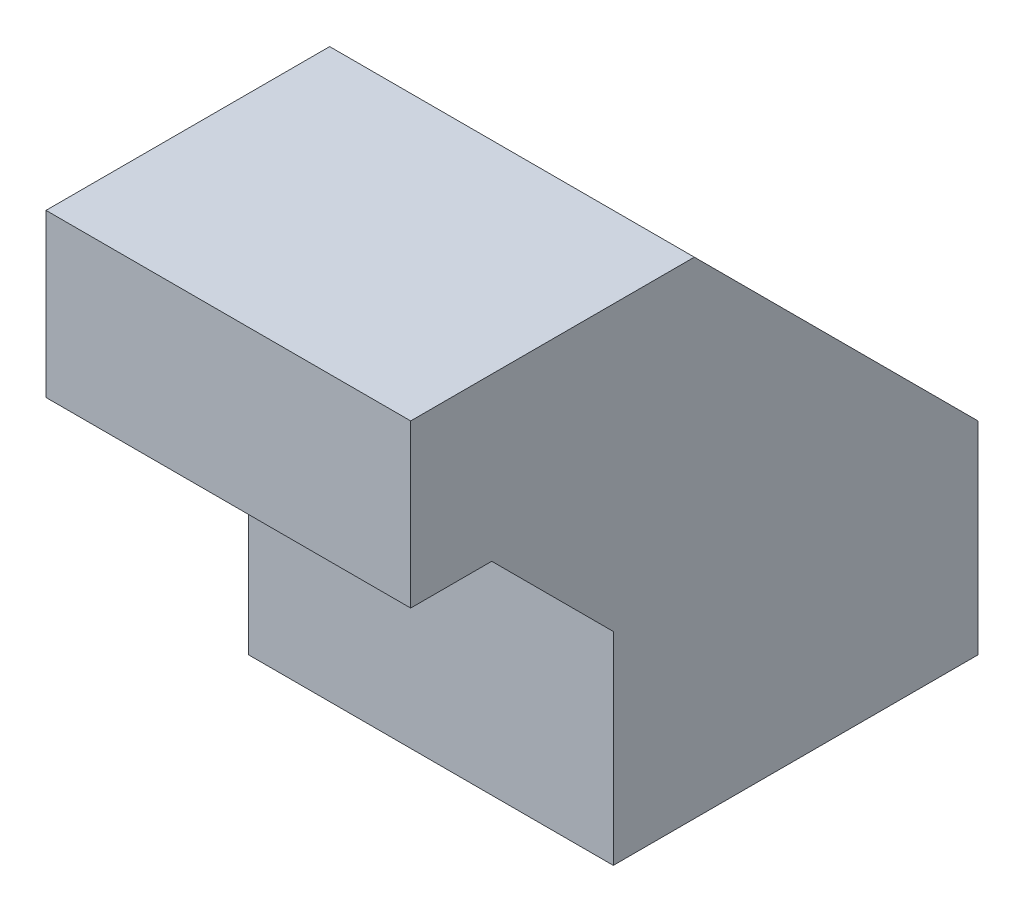
from build123d import *

# Parameters (mm, degrees)
SKETCH1_W           = 45
SKETCH1_H           = 45
BOSS_EXTRUDE1_DEPTH = 40
SKETCH2_W           = 45
SKETCH2_H           = 70
BOSS_EXTRUDE2_DEPTH = 20
CHAMFER1_SIZE       = 15
CHAMFER2_SIZE       = 35
SKETCH3_R           = 20
CUT_EXTRUDE1_DEPTH  = 25
SKETCH4_W           = 40
SKETCH4_H           = 20
CUT_EXTRUDE2_DEPTH  = 49


with BuildPart() as part:
    # Sketch1 → Boss-Extrude1 (new body)
    with BuildSketch(Plane(origin=(0, 0, 0), x_dir=(1, 0, 0), z_dir=(0, 1, 0))):
        Rectangle(SKETCH1_W, SKETCH1_H)
    extrude(amount=BOSS_EXTRUDE1_DEPTH)

    # Sketch2 → Boss-Extrude2 (add)
    with BuildSketch(Plane(origin=(0, 40, 0), x_dir=(1, 0, 0), z_dir=(0, 1, 0))):
        with Locations((0, -12.5)):
            Rectangle(SKETCH2_W, SKETCH2_H)
    extrude(amount=BOSS_EXTRUDE2_DEPTH)

    # Chamfer1
    chamfer1_edges = [part.edges().sort_by_distance(p)[0] for p in [
        (0, 40, 22.5),
    ]]
    chamfer(chamfer1_edges, length=CHAMFER1_SIZE)

    # Chamfer2
    chamfer2_edges = [part.edges().sort_by_distance(p)[0] for p in [
        (0, 60, -22.5),
    ]]
    chamfer(chamfer2_edges, length=CHAMFER2_SIZE)

    # Sketch3 → Cut-Extrude1 (cut)
    with BuildSketch(Plane(origin=(0, 0, 0), x_dir=(1, 0, 0), z_dir=(0, 1, 0))):
        with Locations(Location((0, 0, 0), (0, 0, 270))):
            Circle(SKETCH3_R)
    extrude(amount=CUT_EXTRUDE1_DEPTH, mode=Mode.SUBTRACT)

    # Sketch4 → Cut-Extrude2 (cut)
    with BuildSketch(Plane(origin=(0, 1.414213562, 1.414213562), x_dir=(-1, 0, 0), z_dir=(0, 0.7071067811865476, 0.7071067811865476))):
        with Locations((0, -21.587572106)):
            Rectangle(SKETCH4_W, SKETCH4_H)
    extrude(amount=CUT_EXTRUDE2_DEPTH, mode=Mode.SUBTRACT)


solid = part.part
